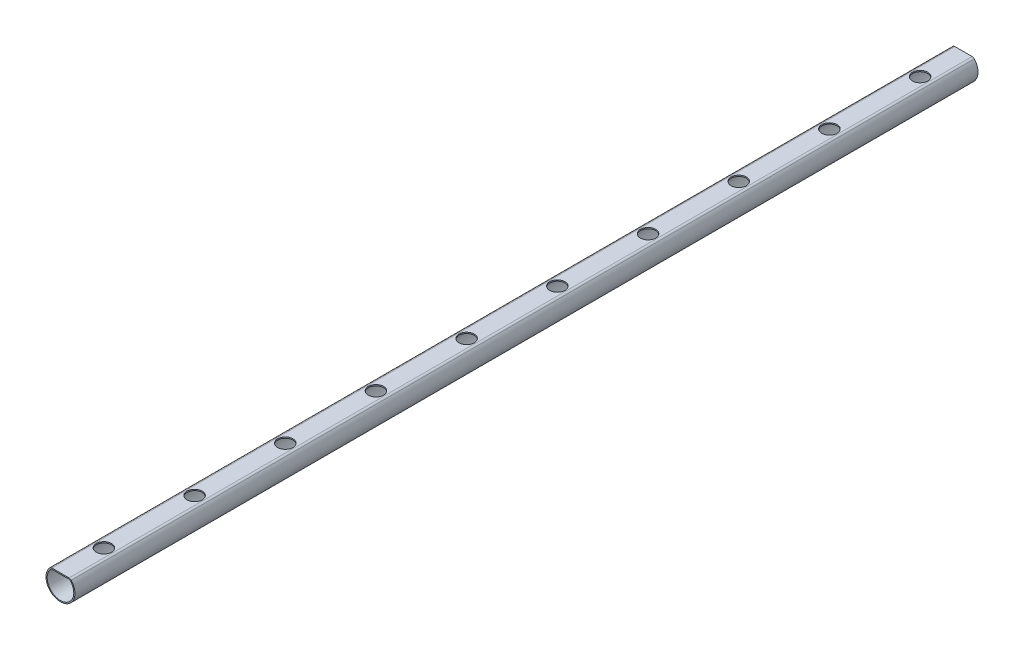
from build123d import *

# Parameters (mm, degrees)
BOSS_EXTRUDE1_DEPTH = 936
CUT_EXTRUDE1_REACH  = 938.481
SKETCH2_R           = 7.9


with BuildPart() as part:
    # Sketch1 → Boss-Extrude1 (new body)
    with BuildSketch(Plane.XY):
        with BuildLine():
            Line((8.94427191, 11), (-8.94427191, 11))
            ThreePointArc((-8.94427191, 11), (-10.169016781, 10.738612788), (-11.180339887, 10))
            ThreePointArc((-11.180339887, 10), (0, -15), (11.180339887, 10))
            ThreePointArc((11.180339887, 10), (10.169016781, 10.738612788), (8.94427191, 11))
        make_face()
        with BuildLine():
            Line((8.94427191, 9.8), (-8.94427191, 9.8))
            ThreePointArc((-8.94427191, 9.8), (-9.679118833, 9.643167673), (-10.285912696, 9.2))
            ThreePointArc((-10.285912696, 9.2), (0, -13.8), (10.285912696, 9.2))
            ThreePointArc((10.285912696, 9.2), (9.679118833, 9.643167673), (8.94427191, 9.8))
        make_face(mode=Mode.SUBTRACT)
    extrude(amount=BOSS_EXTRUDE1_DEPTH)

    # Sketch2 → Cut-Extrude1 (cut, up to next)
    with BuildSketch(Plane(origin=(0, 11, 0), x_dir=(1, 0, 0), z_dir=(0, 1, 0)), mode=Mode.PRIVATE) as cut_extrude1_sk1:
        with Locations(Location((0, -891, 0), (0, 0, 180))):
            Circle(SKETCH2_R)
    cut_extrude1_tool1 = extrude(cut_extrude1_sk1.sketch, amount=-CUT_EXTRUDE1_REACH, mode=Mode.PRIVATE) & part.part
    # Sketch2 → Cut-Extrude1 (cut, up to next)
    with BuildSketch(Plane(origin=(0, 11, 0), x_dir=(1, 0, 0), z_dir=(0, 1, 0)), mode=Mode.PRIVATE) as cut_extrude1_sk2:
        with Locations(Location((0, -797, 0), (0, 0, 180))):
            Circle(SKETCH2_R)
    cut_extrude1_tool2 = extrude(cut_extrude1_sk2.sketch, amount=-CUT_EXTRUDE1_REACH, mode=Mode.PRIVATE) & part.part
    # Sketch2 → Cut-Extrude1 (cut, up to next)
    with BuildSketch(Plane(origin=(0, 11, 0), x_dir=(1, 0, 0), z_dir=(0, 1, 0)), mode=Mode.PRIVATE) as cut_extrude1_sk3:
        with Locations(Location((0, -703, 0), (0, 0, 180))):
            Circle(SKETCH2_R)
    cut_extrude1_tool3 = extrude(cut_extrude1_sk3.sketch, amount=-CUT_EXTRUDE1_REACH, mode=Mode.PRIVATE) & part.part
    # Sketch2 → Cut-Extrude1 (cut, up to next)
    with BuildSketch(Plane(origin=(0, 11, 0), x_dir=(1, 0, 0), z_dir=(0, 1, 0)), mode=Mode.PRIVATE) as cut_extrude1_sk4:
        with Locations(Location((0, -609, 0), (0, 0, 180))):
            Circle(SKETCH2_R)
    cut_extrude1_tool4 = extrude(cut_extrude1_sk4.sketch, amount=-CUT_EXTRUDE1_REACH, mode=Mode.PRIVATE) & part.part
    # Sketch2 → Cut-Extrude1 (cut, up to next)
    with BuildSketch(Plane(origin=(0, 11, 0), x_dir=(1, 0, 0), z_dir=(0, 1, 0)), mode=Mode.PRIVATE) as cut_extrude1_sk5:
        with Locations(Location((0, -515, 0), (0, 0, 180))):
            Circle(SKETCH2_R)
    cut_extrude1_tool5 = extrude(cut_extrude1_sk5.sketch, amount=-CUT_EXTRUDE1_REACH, mode=Mode.PRIVATE) & part.part
    # Sketch2 → Cut-Extrude1 (cut, up to next)
    with BuildSketch(Plane(origin=(0, 11, 0), x_dir=(1, 0, 0), z_dir=(0, 1, 0)), mode=Mode.PRIVATE) as cut_extrude1_sk6:
        with Locations(Location((0, -421, 0), (0, 0, 180))):
            Circle(SKETCH2_R)
    cut_extrude1_tool6 = extrude(cut_extrude1_sk6.sketch, amount=-CUT_EXTRUDE1_REACH, mode=Mode.PRIVATE) & part.part
    # Sketch2 → Cut-Extrude1 (cut, up to next)
    with BuildSketch(Plane(origin=(0, 11, 0), x_dir=(1, 0, 0), z_dir=(0, 1, 0)), mode=Mode.PRIVATE) as cut_extrude1_sk7:
        with Locations(Location((0, -327, 0), (0, 0, 180))):
            Circle(SKETCH2_R)
    cut_extrude1_tool7 = extrude(cut_extrude1_sk7.sketch, amount=-CUT_EXTRUDE1_REACH, mode=Mode.PRIVATE) & part.part
    # Sketch2 → Cut-Extrude1 (cut, up to next)
    with BuildSketch(Plane(origin=(0, 11, 0), x_dir=(1, 0, 0), z_dir=(0, 1, 0)), mode=Mode.PRIVATE) as cut_extrude1_sk8:
        with Locations(Location((0, -233, 0), (0, 0, 180))):
            Circle(SKETCH2_R)
    cut_extrude1_tool8 = extrude(cut_extrude1_sk8.sketch, amount=-CUT_EXTRUDE1_REACH, mode=Mode.PRIVATE) & part.part
    # Sketch2 → Cut-Extrude1 (cut, up to next)
    with BuildSketch(Plane(origin=(0, 11, 0), x_dir=(1, 0, 0), z_dir=(0, 1, 0)), mode=Mode.PRIVATE) as cut_extrude1_sk9:
        with Locations(Location((0, -139, 0), (0, 0, 180))):
            Circle(SKETCH2_R)
    cut_extrude1_tool9 = extrude(cut_extrude1_sk9.sketch, amount=-CUT_EXTRUDE1_REACH, mode=Mode.PRIVATE) & part.part
    # Sketch2 → Cut-Extrude1 (cut, up to next)
    with BuildSketch(Plane(origin=(0, 11, 0), x_dir=(1, 0, 0), z_dir=(0, 1, 0)), mode=Mode.PRIVATE) as cut_extrude1_sk10:
        with Locations(Location((0, -45, 0), (0, 0, 180))):
            Circle(SKETCH2_R)
    cut_extrude1_tool10 = extrude(cut_extrude1_sk10.sketch, amount=-CUT_EXTRUDE1_REACH, mode=Mode.PRIVATE) & part.part
    add(cut_extrude1_tool1.solids().sort_by_distance((0, 11, 891))[0], mode=Mode.SUBTRACT)
    add(cut_extrude1_tool2.solids().sort_by_distance((0, 11, 797))[0], mode=Mode.SUBTRACT)
    add(cut_extrude1_tool3.solids().sort_by_distance((0, 11, 703))[0], mode=Mode.SUBTRACT)
    add(cut_extrude1_tool4.solids().sort_by_distance((0, 11, 609))[0], mode=Mode.SUBTRACT)
    add(cut_extrude1_tool5.solids().sort_by_distance((0, 11, 515))[0], mode=Mode.SUBTRACT)
    add(cut_extrude1_tool6.solids().sort_by_distance((0, 11, 421))[0], mode=Mode.SUBTRACT)
    add(cut_extrude1_tool7.solids().sort_by_distance((0, 11, 327))[0], mode=Mode.SUBTRACT)
    add(cut_extrude1_tool8.solids().sort_by_distance((0, 11, 233))[0], mode=Mode.SUBTRACT)
    add(cut_extrude1_tool9.solids().sort_by_distance((0, 11, 139))[0], mode=Mode.SUBTRACT)
    add(cut_extrude1_tool10.solids().sort_by_distance((0, 11, 45))[0], mode=Mode.SUBTRACT)


solid = part.part
